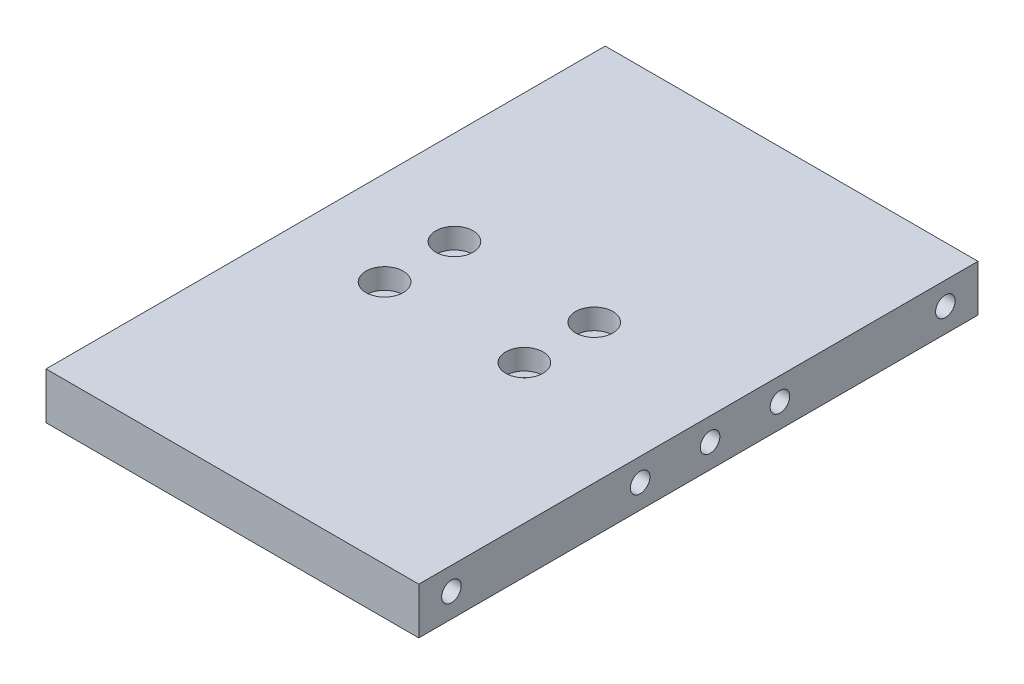
from build123d import *

# Parameters (mm, degrees)
SKETCH1_W                                           = 80
SKETCH1_H                                           = 120
BOSS_EXTRUDE1_DEPTH                                 = 5
M5_TAPPED_HOLE1_D                                   = 4.2
M5_TAPPED_HOLE1_DEPTH                               = 20
M5_TAPPED_HOLE1_TIP                                 = 1.2618073
SKETCH6_W                                           = 40
SKETCH6_H                                           = 30
CUT_EXTRUDE2_DEPTH                                  = 3
CBORE_FOR_M4_HEX_SOCKET_HEAD_CAP_SCREW1_D           = 4.5
CBORE_FOR_M4_HEX_SOCKET_HEAD_CAP_SCREW1_DEPTH       = 20
CBORE_FOR_M4_HEX_SOCKET_HEAD_CAP_SCREW1_CBORE_D     = 8
CBORE_FOR_M4_HEX_SOCKET_HEAD_CAP_SCREW1_CBORE_DEPTH = 4.4
CBORE_FOR_M4_HEX_SOCKET_HEAD_CAP_SCREW1_TIP         = 1.351936393


with BuildPart() as part:
    # Sketch1 → Boss-Extrude1 (new, symmetric)
    with BuildSketch(Plane(origin=(0, 0, 0), x_dir=(1, 0, 0), z_dir=(0, 1, 0))):
        Rectangle(SKETCH1_W, SKETCH1_H)
    extrude(amount=BOSS_EXTRUDE1_DEPTH, both=True)

    # M5 Tapped Hole1
    with Locations(Plane(origin=(40, 0, 17.5), x_dir=(0, 0, 1), z_dir=(1, 0, 0))):
        with Locations((-70.5, -0.150021458), (-35, -0.150021458), (-20, -0.150021458), (-5, -0.150021458), (35.5, -0.150021458)):
            Hole(M5_TAPPED_HOLE1_D / 2, depth=M5_TAPPED_HOLE1_DEPTH)
            with Locations((0, 0, -(M5_TAPPED_HOLE1_DEPTH + M5_TAPPED_HOLE1_TIP / 2))):  # 118° drill point
                Cone(0, M5_TAPPED_HOLE1_D / 2, M5_TAPPED_HOLE1_TIP, mode=Mode.SUBTRACT)

    # Sketch6 → Cut-Extrude2 (cut)
    with BuildSketch(Plane.XZ.offset(5)):
        with Locations((-4.85, 0)):
            Rectangle(SKETCH6_W, SKETCH6_H)
    extrude(amount=-CUT_EXTRUDE2_DEPTH, mode=Mode.SUBTRACT)

    # CBORE for M4 Hex Socket Head Cap Screw1
    with Locations(Plane(origin=(0, 5, 0), x_dir=(1, 0, 0), z_dir=(0, 1, 0))):
        with Locations((-19.85000137, 7.5), (10.14999863, 7.5), (10.14999863, -7.5), (-19.85000137, -7.5)):
            CounterBoreHole(CBORE_FOR_M4_HEX_SOCKET_HEAD_CAP_SCREW1_D / 2, CBORE_FOR_M4_HEX_SOCKET_HEAD_CAP_SCREW1_CBORE_D / 2, CBORE_FOR_M4_HEX_SOCKET_HEAD_CAP_SCREW1_CBORE_DEPTH, depth=CBORE_FOR_M4_HEX_SOCKET_HEAD_CAP_SCREW1_DEPTH)
            with Locations((0, 0, -(CBORE_FOR_M4_HEX_SOCKET_HEAD_CAP_SCREW1_DEPTH + CBORE_FOR_M4_HEX_SOCKET_HEAD_CAP_SCREW1_TIP / 2))):  # 118° drill point
                Cone(0, CBORE_FOR_M4_HEX_SOCKET_HEAD_CAP_SCREW1_D / 2, CBORE_FOR_M4_HEX_SOCKET_HEAD_CAP_SCREW1_TIP, mode=Mode.SUBTRACT)


solid = part.part
